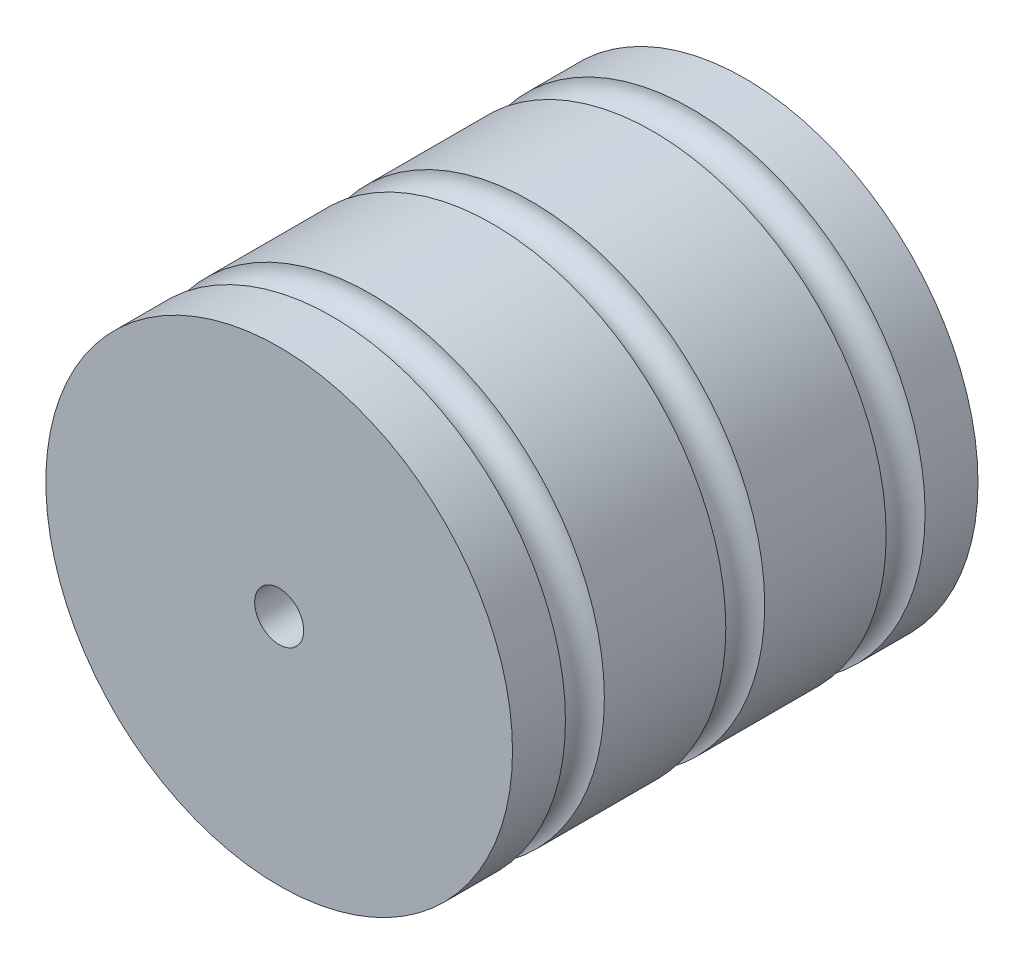
from build123d import *


with BuildPart() as part:
    # Sketch1 → Revolve1 (revolve)
    with BuildSketch(Plane(origin=(0, 0, 0), x_dir=(1, 0, 0), z_dir=(0, 1, 0))):
        with BuildLine():
            Line((4, 0), (38.1, 0))
            Line((38.1, 0), (38.1, 8.642197741))
            ThreePointArc((38.1, 8.642197741), (34.925, 11.817197741), (38.1, 14.992197741))
            Line((38.1, 14.992197741), (38.1, 34.825))
            ThreePointArc((38.1, 34.825), (34.925, 38), (38.1, 41.175))
            Line((38.1, 41.175), (38.1, 61.007802259))
            ThreePointArc((38.1, 61.007802259), (34.925, 64.182802259), (38.1, 67.357802259))
            Line((38.1, 67.357802259), (38.1, 76))
            Line((38.1, 76), (4, 76))
            Line((4, 76), (4, 0))
        make_face()
    revolve(axis=Axis((0, 0, 0), (0, 0, -1)))


solid = part.part
